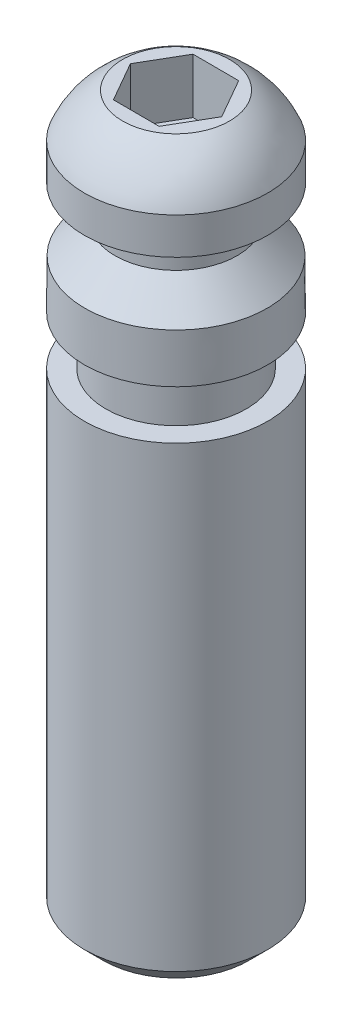
from build123d import *

# Parameters (mm, degrees)
SKETCH1_R           = 3
BOSS_EXTRUDE1_DEPTH = 23.5
CHAMFER1_SIZE       = 0.625
CUT_EXTRUDE1_DEPTH  = 1.8


with BuildPart() as part:
    # Sketch1 → Boss-Extrude1 (new body)
    with BuildSketch(Plane(origin=(0, 0, 0), x_dir=(1, 0, 0), z_dir=(0, 1, 0))):
        with Locations(Location((0, 0, 0), (0, 0, 270))):
            Circle(SKETCH1_R)
    extrude(amount=BOSS_EXTRUDE1_DEPTH)

    # Sketch2 → Cut-Revolve1 (revolve, cut)
    with BuildSketch(Plane.XY, mode=Mode.PRIVATE) as cut_revolve1_sk:
        with BuildLine():
            Line((3, 22.081556921), (3, 20.881556921))
            Line((3, 20.881556921), (1.995368836, 20.301532848))
            Line((1.995368836, 20.301532848), (1.995368836, 19.801532848))
            Line((1.995368836, 19.801532848), (2.986803407, 18.810098278))
            Line((2.986803407, 18.810098278), (3, 17.210098278))
            Line((3, 17.210098278), (2.3, 17.210098278))
            Line((2.3, 17.210098278), (2.3, 15.610098278))
            Line((2.3, 15.610098278), (3, 15.610098278))
            Line((3, 15.610098278), (5.142193945, 15.610098278))
            Line((5.142193945, 15.610098278), (5.142193945, 23.5))
            Line((5.142193945, 23.5), (1.75, 23.5))
            ThreePointArc((1.75, 23.5), (2.493968727, 22.895619403), (3, 22.081556921))
        make_face()
    revolve(cut_revolve1_sk.sketch.rotate(Axis((0, 23.5, 0), (0, -1, 0)), 90), axis=Axis((0, 23.5, 0), (0, -1, 0)), mode=Mode.SUBTRACT)

    # Chamfer1
    chamfer1_edges = [part.edges().sort_by_distance(p)[0] for p in [
        (0, 0, -3),
    ]]
    chamfer(chamfer1_edges, length=CHAMFER1_SIZE)

    # Sketch3 → Cut-Extrude1 (cut)
    with BuildSketch(Plane(origin=(0, 23.5, 0), x_dir=(1, 0, 0), z_dir=(0, 1, 0))):
        Polygon((0.745992991, -1.301343328), (1.499992877, -0.004622783), (0.753999886, 1.296720545), (-0.745992991, 1.301343328), (-1.499992877, 0.004622783), (-0.753999886, -1.296720545), align=None)
    extrude(amount=-CUT_EXTRUDE1_DEPTH, mode=Mode.SUBTRACT)


solid = part.part
